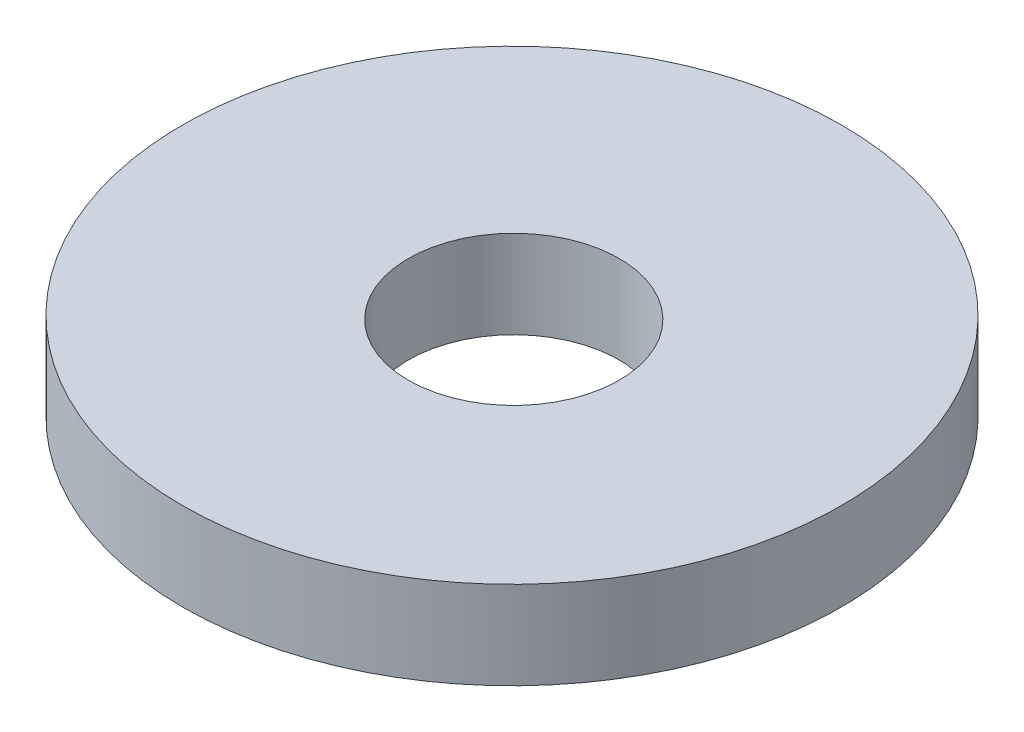
from build123d import *

# Parameters (mm, degrees)
SKETCH1_R            = 3.75
BOSS_EXTRUDE1_DEPTH  = 1
M2_CLEARANCE_HOLE1_D = 2.4


with BuildPart() as part:
    # Sketch1 → Boss-Extrude1 (new body)
    with BuildSketch(Plane(origin=(0, 0, 0), x_dir=(1, 0, 0), z_dir=(0, 1, 0))):
        with Locations(Location((0, 0, 0), (0, 0, 270))):
            Circle(SKETCH1_R)
    extrude(amount=BOSS_EXTRUDE1_DEPTH)

    # M2 Clearance Hole1 (through all)
    with Locations(Plane(origin=(0, 1, 0), x_dir=(1, 0, 0), z_dir=(0, 1, 0))):
        with Locations((0.050446394, -0.030211061)):
            Hole(M2_CLEARANCE_HOLE1_D / 2)


solid = part.part
